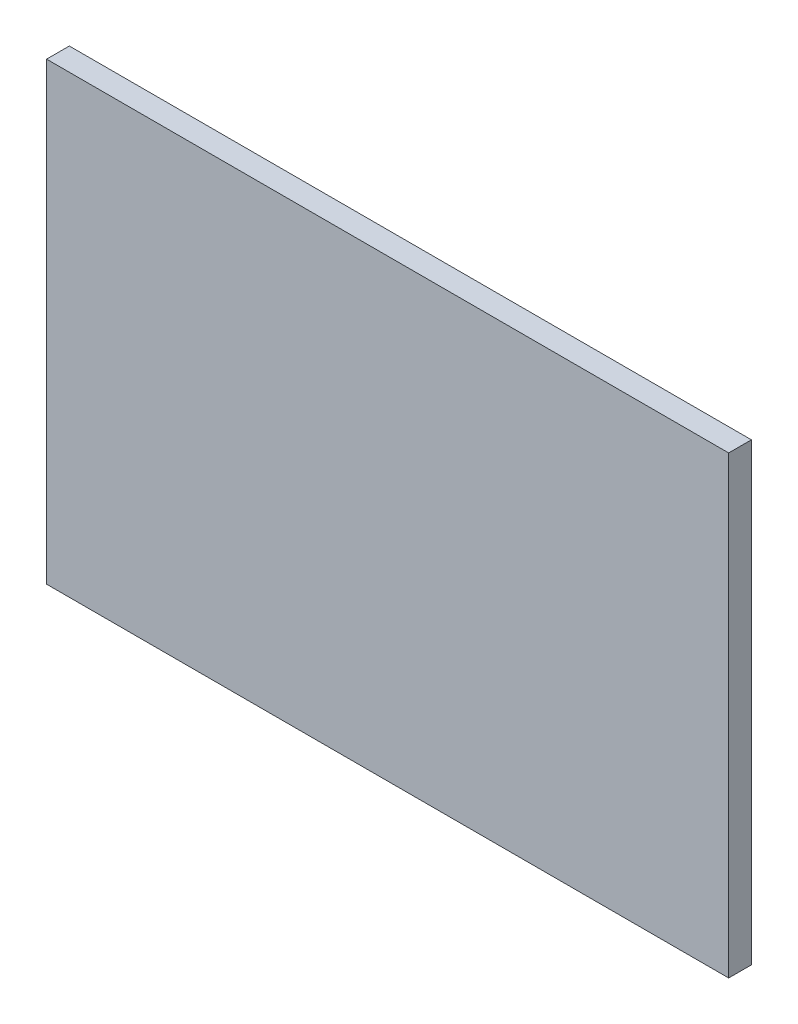
from build123d import *

# Parameters (mm, degrees)
SKETCH2_W  = 750
SKETCH2_H  = 500
BASE_DEPTH = 25


with BuildPart() as part:
    # Sketch2 → base (new body)
    with BuildSketch(Plane.XY):
        with Locations((375, 250)):
            Rectangle(SKETCH2_W, SKETCH2_H)
    extrude(amount=BASE_DEPTH)


solid = part.part
